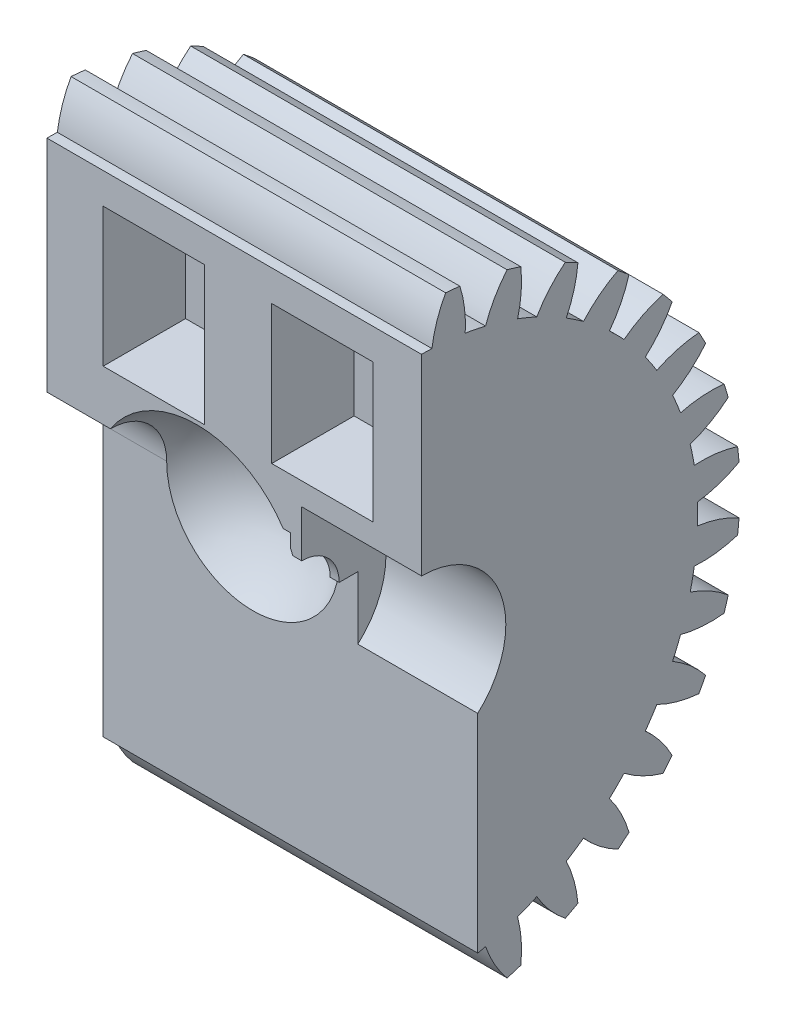
from build123d import *

# Parameters (mm, degrees)
BASPROSKE_W             = 10
BASPROSKE_H             = 8.5
TOOTHCUT_DEPTH          = 16.636495771
TEETHCUTS_COUNT         = 32
BORSKE_R                = 1
BORE_DEPTH              = 50.0000508
SKETCH1_R               = 2.25
CUT_EXTRUDE1_DEPTH      = 3.2
SKETCH2_W               = 3
SKETCH2_H               = 10
CUT_EXTRUDE2_DEPTH      = 16.610070769
CUT_EXTRUDE3_DEPTH      = 17.472745672
CUT_EXTRUDE3_DEPTH_BACK = 17.472745672
SKETCH3_R               = 0.6
SKETCH4_R               = 1.5
CUT_EXTRUDE4_DEPTH      = 6.5
SKETCH7_W               = 10.973728646
SKETCH7_H               = 17.598113622
CUT_EXTRUDE5_DEPTH      = 10
SKETCH8_W               = 2.7
SKETCH8_H               = 3.7
CUT_EXTRUDE6_DEPTH      = 2.2


with BuildPart() as part:
    # BasProSke → Base-Revolve (revolve)
    with BuildSketch(Plane(origin=(0, 0, 0), x_dir=(1, 0, 0), z_dir=(0, 1, 0)), mode=Mode.PRIVATE) as base_revolve_sk:
        with Locations((5, 4.25)):
            Rectangle(BASPROSKE_W, BASPROSKE_H)
    revolve(base_revolve_sk.sketch.rotate(Axis((-10, 0, 0), (1, 0, 0)), 180), axis=Axis((-10, 0, 0), (1, 0, 0)))

    # TooCutSke → ToothCut (cut, through all)
    with BuildSketch(Plane(origin=(0, 0, 0), x_dir=(0, 0, -1), z_dir=(1, 0, 0))):
        with BuildLine():
            ThreePointArc((0.277002447, 7.3687954), (0, 7.374), (-0.277002447, 7.3687954))
            ThreePointArc((-0.277002447, 7.3687954), (-0.41335061, 7.952280695), (-0.656086882, 8.500117362))
            ThreePointArc((-0.656086882, 8.500117362), (0, 8.5254), (0.656086882, 8.500117362))
            ThreePointArc((0.656086882, 8.500117362), (0.41335061, 7.952280695), (0.277002447, 7.3687954))
        make_face()
    toothcut = extrude(amount=TOOTHCUT_DEPTH, mode=Mode.SUBTRACT)

    # TeethCuts: ToothCut ×32 about axis
    teethcuts_axis = Axis((0, 0, 0), (1, 0, 0))
    for i in range(1, TEETHCUTS_COUNT):
        add(toothcut.rotate(teethcuts_axis, i * 360 / TEETHCUTS_COUNT), mode=Mode.SUBTRACT)

    # BorSke → Bore (cut, symmetric)
    with BuildSketch(Plane(origin=(0, 0, 0), x_dir=(0, 0, -1), z_dir=(1, 0, 0))):
        with Locations(Location((0, 0, 0), (0, 0, 180))):
            Circle(BORSKE_R)
    extrude(amount=BORE_DEPTH, both=True, mode=Mode.SUBTRACT)

    # Sketch1 → Cut-Extrude1 (cut)
    with BuildSketch(Plane(origin=(10, 0, 0), x_dir=(0, 0, -1), z_dir=(1, 0, 0))):
        Circle(SKETCH1_R)
    extrude(amount=-CUT_EXTRUDE1_DEPTH, mode=Mode.SUBTRACT)

    # Sketch2 → Cut-Extrude2 (cut, through all)
    with BuildSketch(Plane.ZY):
        with Locations((0, -5)):
            Rectangle(SKETCH2_W, SKETCH2_H)
    extrude(amount=-CUT_EXTRUDE2_DEPTH, mode=Mode.SUBTRACT)

    # Sketch3 → Cut-Extrude3 (cut, two sides: drawn at the far end of the back side and taken through both)
    with BuildSketch(Plane.XY.offset(-1.5).offset(-CUT_EXTRUDE3_DEPTH_BACK)):
        with Locations((4, 0)):
            Circle(SKETCH3_R)
    extrude(amount=CUT_EXTRUDE3_DEPTH + CUT_EXTRUDE3_DEPTH_BACK, mode=Mode.SUBTRACT)

    # Sketch4 → Cut-Extrude4 (cut)
    with BuildSketch(Plane.ZY):
        Circle(SKETCH4_R)
    extrude(amount=-CUT_EXTRUDE4_DEPTH, mode=Mode.SUBTRACT)

    # Sketch6 → Cut-Revolve1 (revolve, cut)
    with BuildSketch(Plane.XY):
        with BuildLine():
            ThreePointArc((4, 2.75), (6.75, 0), (4, -2.75))
            Line((4, -2.75), (4, 0))
            Line((4, 0), (4, 2.75))
        make_face()
    revolve(axis=Axis((4, 0, 0), (0, -1, 0)), mode=Mode.SUBTRACT)

    # Sketch7 → Cut-Extrude5 (cut)
    with BuildSketch(Plane.XY):
        with Locations((4.910782694, 0.110648149)):
            Rectangle(SKETCH7_W, SKETCH7_H)
    extrude(amount=CUT_EXTRUDE5_DEPTH, mode=Mode.SUBTRACT)

    # Sketch8 → Cut-Extrude6 (cut)
    with BuildSketch(Plane.XY):
        with Locations((7.35, 4.7)):
            Rectangle(SKETCH8_W, SKETCH8_H)
        with Locations((2.85, 4.7)):
            Rectangle(SKETCH8_W, SKETCH8_H)
    extrude(amount=-CUT_EXTRUDE6_DEPTH, mode=Mode.SUBTRACT)


solid = part.part
